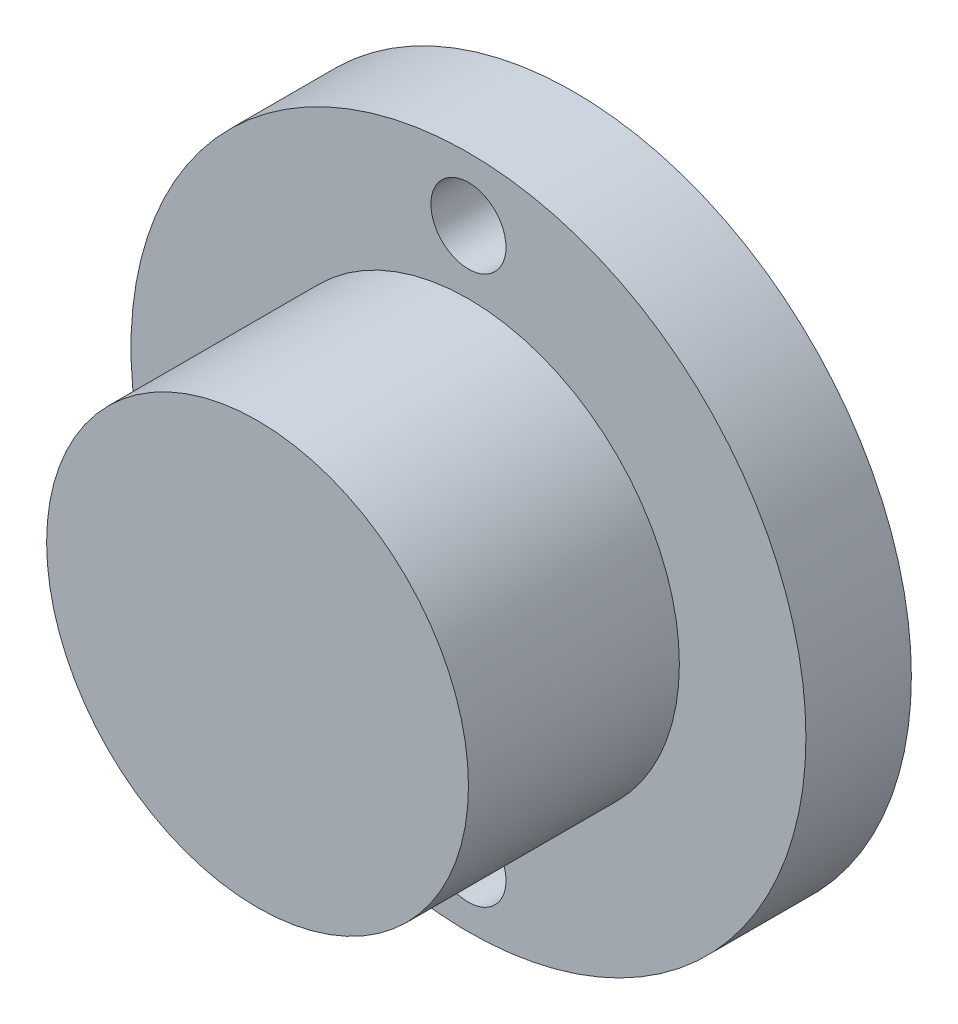
from build123d import *

# Parameters (mm, degrees)
SKETCH1_R           = 10.16
BOSS_EXTRUDE2_DEPTH = 3.175
SKETCH4_R           = 6.35
BOSS_EXTRUDE3_DEPTH = 6.35
SKETCH5_R           = 4.7625
CUT_EXTRUDE3_DEPTH  = 6.35
SKETCH6_R           = 1.1303
CUT_EXTRUDE4_DEPTH  = 16.709032434


with BuildPart() as part:
    # Sketch1 → Boss-Extrude2 (new body)
    with BuildSketch(Plane.XY):
        Circle(SKETCH1_R)
    extrude(amount=BOSS_EXTRUDE2_DEPTH)

    # Sketch4 → Boss-Extrude3 (add)
    with BuildSketch(Plane.XY.offset(3.175)):
        Circle(SKETCH4_R)
    extrude(amount=BOSS_EXTRUDE3_DEPTH)

    # Sketch5 → Cut-Extrude3 (cut)
    with BuildSketch(Plane(origin=(0, 0, 0), x_dir=(-1, 0, 0), z_dir=(0, 0, -1))):
        Circle(SKETCH5_R)
    extrude(amount=-CUT_EXTRUDE3_DEPTH, mode=Mode.SUBTRACT)

    # Sketch6 → Cut-Extrude4 (cut, through all)
    with BuildSketch(Plane.XY.offset(3.175)):
        with Locations((0, 8.255)):
            Circle(SKETCH6_R)
        with Locations((0, -8.255)):
            Circle(SKETCH6_R)
    extrude(amount=-CUT_EXTRUDE4_DEPTH, mode=Mode.SUBTRACT)


solid = part.part
